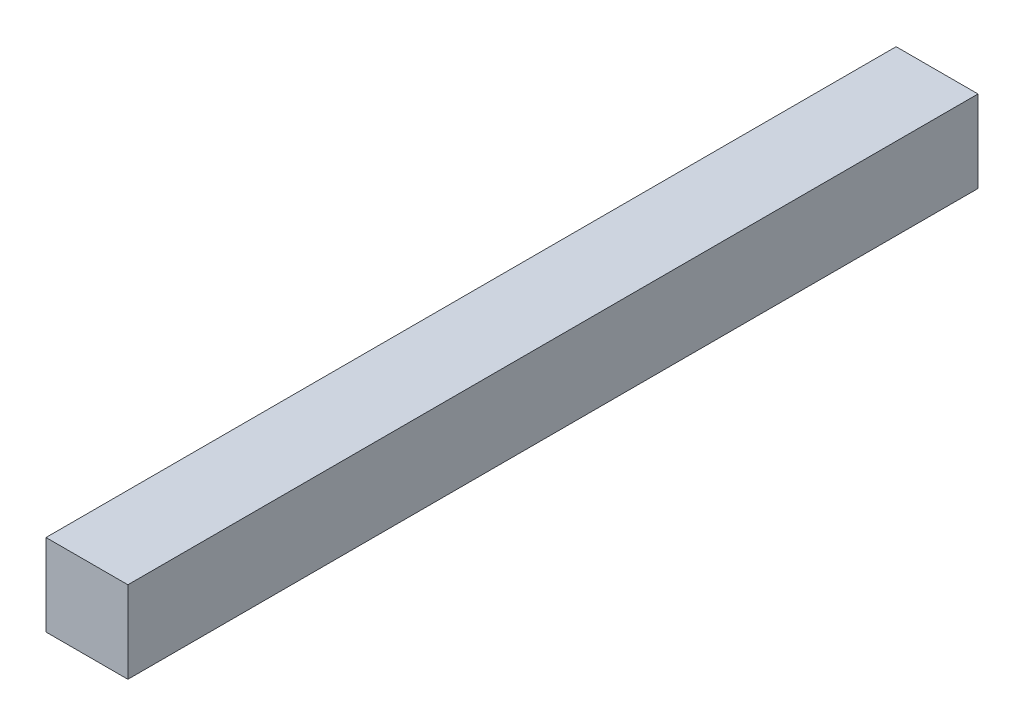
from build123d import *

# Parameters (mm, degrees)
SKETCH1_W           = 36.7
SKETCH1_H           = 36.7
BOSS_EXTRUDE1_DEPTH = 381


with BuildPart() as part:
    # Sketch1 → Boss-Extrude1 (new body)
    with BuildSketch(Plane(origin=(0, 0, 0), x_dir=(0, 1, 0), z_dir=(0, 0, 1))):
        with Locations((18.35, 18.35)):
            Rectangle(SKETCH1_W, SKETCH1_H)
    extrude(amount=BOSS_EXTRUDE1_DEPTH)


solid = part.part
